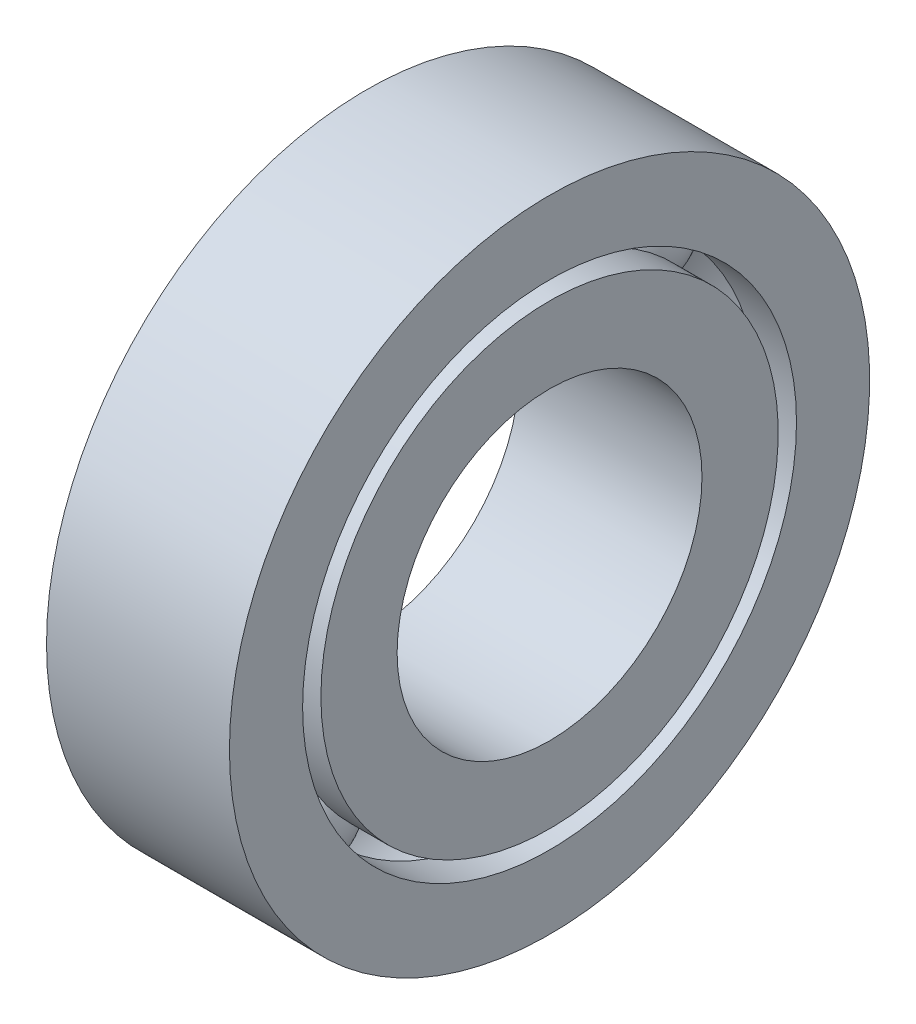
from build123d import *

# Parameters (mm, degrees)
DAIRESEL_KAPLAMA9_COUNT = 8


with BuildPart() as part:
    # Çizim1 → Döndür1 (revolve)
    with BuildSketch(Plane.XY, mode=Mode.PRIVATE) as d_nd_r1_sk:
        with BuildLine():
            Line((0, 21), (0, 16.2))
            Line((0, 16.2), (2.55181207, 16.2))
            ThreePointArc((2.55181207, 16.2), (6, 19.1), (9.44818793, 16.2))
            Line((9.44818793, 16.2), (12, 16.2))
            Line((12, 16.2), (12, 21))
            Line((12, 21), (0, 21))
        make_face()
        with BuildLine():
            Line((0, 10), (12, 10))
            Line((12, 10), (12, 15))
            Line((12, 15), (9.44818793, 15))
            ThreePointArc((9.44818793, 15), (6, 12.1), (2.55181207, 15))
            Line((2.55181207, 15), (0, 15))
            Line((0, 15), (0, 10))
        make_face()
    revolve(d_nd_r1_sk.sketch.rotate(Axis((0, 0, 0), (1, 0, 0)), 90), axis=Axis((0, 0, 0), (1, 0, 0)))


with BuildPart() as body_2:
    # Çizim2 → Döndür2 (revolve)
    with BuildSketch(Plane.XY):
        with BuildLine():
            Line((2.6, 15.6), (9.4, 15.6))
            ThreePointArc((9.4, 15.6), (6, 19), (2.6, 15.6))
        make_face()
    revolve(axis=Axis((2.6, 15.6, 0), (1, 0, 0)))


with BuildPart() as dairesel_kaplama9_1:
    # Dairesel Kaplama9: pattern copy
    add(body_2.part.rotate(Axis((0, 0, 0), (1, 0, 0)), 1 * 360 / DAIRESEL_KAPLAMA9_COUNT))


with BuildPart() as dairesel_kaplama9_2:
    # Dairesel Kaplama9: pattern copy
    add(body_2.part.rotate(Axis((0, 0, 0), (1, 0, 0)), 2 * 360 / DAIRESEL_KAPLAMA9_COUNT))


with BuildPart() as dairesel_kaplama9_3:
    # Dairesel Kaplama9: pattern copy
    add(body_2.part.rotate(Axis((0, 0, 0), (1, 0, 0)), 3 * 360 / DAIRESEL_KAPLAMA9_COUNT))


with BuildPart() as dairesel_kaplama9_4:
    # Dairesel Kaplama9: pattern copy
    add(body_2.part.rotate(Axis((0, 0, 0), (1, 0, 0)), 4 * 360 / DAIRESEL_KAPLAMA9_COUNT))


with BuildPart() as dairesel_kaplama9_5:
    # Dairesel Kaplama9: pattern copy
    add(body_2.part.rotate(Axis((0, 0, 0), (1, 0, 0)), 5 * 360 / DAIRESEL_KAPLAMA9_COUNT))


with BuildPart() as dairesel_kaplama9_6:
    # Dairesel Kaplama9: pattern copy
    add(body_2.part.rotate(Axis((0, 0, 0), (1, 0, 0)), 6 * 360 / DAIRESEL_KAPLAMA9_COUNT))


with BuildPart() as dairesel_kaplama9_7:
    # Dairesel Kaplama9: pattern copy
    add(body_2.part.rotate(Axis((0, 0, 0), (1, 0, 0)), 7 * 360 / DAIRESEL_KAPLAMA9_COUNT))


solid = Compound([part.part, body_2.part, dairesel_kaplama9_1.part, dairesel_kaplama9_2.part, dairesel_kaplama9_3.part, dairesel_kaplama9_4.part, dairesel_kaplama9_5.part, dairesel_kaplama9_6.part, dairesel_kaplama9_7.part])
